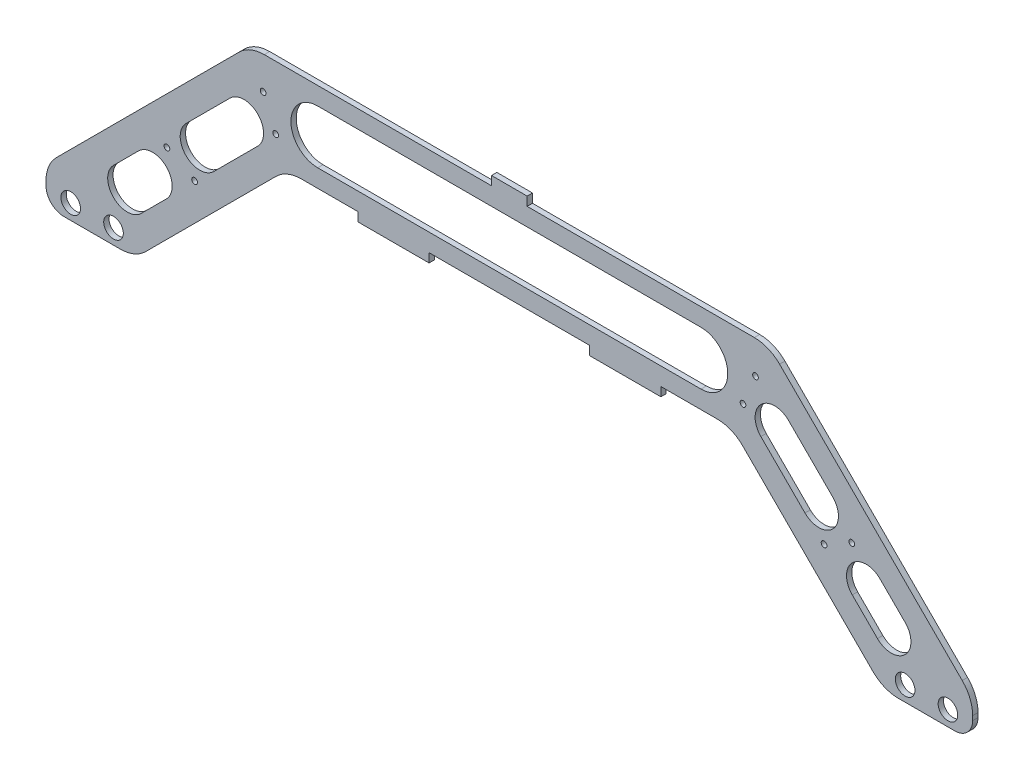
from build123d import *

# Parameters (mm, degrees)
SKETCH_1_R          = 5.5
EXTRUDE_1_DEPTH     = 1.5
CUT_EXTRUDE_6_DEPTH = 283.134941999
SKETCH_2_5_R        = 1.6
CUT_EXTRUDE_7_DEPTH = 283.134941999


with BuildPart() as part:
    # 草图1 → 凸台-拉伸1 (new, symmetric)
    with BuildSketch(Plane.XY):
        with BuildLine():
            Line((-10, 25), (-125, 25))
            Line((-125, 25), (-137.426406871, 25))
            ThreePointArc((-137.426406871, 25), (-145.080075518, 23.47759065), (-151.568542495, 19.142135624))
            Line((-151.568542495, 19.142135624), (-202.781745931, -32.071067812))
            Line((-202.781745931, -32.071067812), (-253.994949366, -83.284271247))
            ThreePointArc((-253.994949366, -83.284271247), (-258.330404393, -89.772738224), (-259.852813742, -97.426406871))
            Line((-259.852813742, -97.426406871), (-259.852813742, -99.852813742))
            ThreePointArc((-259.852813742, -99.852813742), (-256.923881554, -106.923881554), (-249.852813742, -109.852813742))
            Line((-249.852813742, -109.852813742), (-245.994949366, -109.852813742))
            Line((-245.994949366, -109.852813742), (-233.994949366, -109.852813742))
            Line((-233.994949366, -109.852813742), (-218.13708499, -109.852813742))
            ThreePointArc((-218.13708499, -109.852813742), (-210.483416343, -108.330404393), (-203.994949366, -103.994949366))
            Line((-203.994949366, -103.994949366), (-130.857864376, -30.857864376))
            ThreePointArc((-130.857864376, -30.857864376), (-124.3693974, -26.52240935), (-116.715728753, -25))
            Line((-116.715728753, -25), (-85, -25))
            Line((-85, -25), (-85, -30))
            Line((-85, -30), (-65, -30))
            Line((-65, -30), (-45, -30))
            Line((-45, -30), (-45, -25))
            Line((-45, -25), (0, -25))
            Line((0, -25), (45, -25))
            Line((45, -25), (45, -30))
            Line((45, -30), (65, -30))
            Line((65, -30), (85, -30))
            Line((85, -30), (85, -25))
            Line((85, -25), (116.715728753, -25))
            ThreePointArc((116.715728753, -25), (124.3693974, -26.52240935), (130.857864376, -30.857864376))
            Line((130.857864376, -30.857864376), (203.994949366, -103.994949366))
            ThreePointArc((203.994949366, -103.994949366), (210.483416343, -108.330404393), (218.13708499, -109.852813742))
            Line((218.13708499, -109.852813742), (249.852813742, -109.852813742))
            ThreePointArc((249.852813742, -109.852813742), (256.923881554, -106.923881554), (259.852813742, -99.852813742))
            Line((259.852813742, -99.852813742), (259.852813742, -97.426406871))
            ThreePointArc((259.852813742, -97.426406871), (258.330404393, -89.772738224), (253.994949366, -83.284271247))
            Line((253.994949366, -83.284271247), (202.781745931, -32.071067812))
            Line((202.781745931, -32.071067812), (151.568542495, 19.142135624))
            ThreePointArc((151.568542495, 19.142135624), (145.080075518, 23.47759065), (137.426406871, 25))
            Line((137.426406871, 25), (125, 25))
            Line((125, 25), (10, 25))
            Line((10, 25), (10, 30))
            Line((10, 30), (-10, 30))
            Line((-10, 30), (-10, 25))
        make_face()
        with BuildLine():
            ThreePointArc((-240.494949366, -101.352813742), (-242.10586207, -105.241901039), (-245.994949366, -106.852813742))
            ThreePointArc((-245.994949366, -106.852813742), (-249.884036663, -97.463726446), (-240.494949366, -101.352813742))
        make_face(mode=Mode.SUBTRACT)
        with Locations((-221.994949366, -101.352813742)):
            Circle(SKETCH_1_R, mode=Mode.SUBTRACT)
        with Locations((221.994949366, -101.352813742)):
            Circle(SKETCH_1_R, mode=Mode.SUBTRACT)
        with Locations((245.994949366, -101.352813742)):
            Circle(SKETCH_1_R, mode=Mode.SUBTRACT)
    extrude(amount=EXTRUDE_1_DEPTH, both=True)

    # 草图2 → 切除-拉伸6 (cut, through all)
    with BuildSketch(Plane.XY.offset(1.5)):
        with BuildLine():
            Line((107.5, 15), (-107.5, 15))
            ThreePointArc((-107.5, 15), (-122.5, 0), (-107.5, -15))
            Line((-107.5, -15), (107.5, -15))
            ThreePointArc((107.5, -15), (122.5, 0), (107.5, 15))
        make_face()
    extrude(amount=-CUT_EXTRUDE_6_DEPTH, mode=Mode.SUBTRACT)

    # 草图2<5> → 切除-拉伸7 (cut, through all)
    with BuildSketch(Plane.XY.offset(1.5)):
        with Locations((-138.075378798, 6.566756826)):
            Circle(SKETCH_2_5_R)
        with Locations((-131.045941546, -10.403805922)):
            Circle(SKETCH_2_5_R)
        with Locations((-176.520445456, -55.878309832)):
            Circle(SKETCH_2_5_R)
        with Locations((-192.035164082, -47.393028458)):
            Circle(SKETCH_2_5_R)
        with Locations((131.045941546, -10.403805922)):
            Circle(SKETCH_2_5_R)
        with Locations((138.075378798, 6.566756826)):
            Circle(SKETCH_2_5_R)
        with Locations((176.520445456, -55.878309832)):
            Circle(SKETCH_2_5_R)
        with Locations((192.035164082, -47.393028458)):
            Circle(SKETCH_2_5_R)
        with BuildLine():
            Line((-141.060660172, -21.261670299), (-165.809397513, -46.01040764))
            ThreePointArc((-165.809397513, -46.01040764), (-181.365746699, -46.01040764), (-181.365746699, -30.454058454))
            Line((-181.365746699, -30.454058454), (-156.617009358, -5.705321112))
            ThreePointArc((-156.617009358, -5.705321112), (-141.060660172, -5.705321112), (-141.060660172, -21.261670299))
        make_face()
        with BuildLine():
            Line((-222.024386618, -71.112698372), (-207.882250994, -56.970562748))
            ThreePointArc((-207.882250994, -56.970562748), (-192.325901808, -56.970562748), (-192.325901808, -72.526911935))
            Line((-192.325901808, -72.526911935), (-206.468037432, -86.669047558))
            ThreePointArc((-206.468037432, -86.669047558), (-222.024386618, -86.669047558), (-222.024386618, -71.112698372))
        make_face()
        with BuildLine():
            Line((141.060660172, -21.261670299), (165.809397513, -46.01040764))
            ThreePointArc((165.809397513, -46.01040764), (181.365746699, -46.01040764), (181.365746699, -30.454058454))
            Line((181.365746699, -30.454058454), (156.617009358, -5.705321112))
            ThreePointArc((156.617009358, -5.705321112), (141.060660172, -5.705321112), (141.060660172, -21.261670299))
        make_face()
        with BuildLine():
            Line((222.024386618, -71.112698372), (207.882250994, -56.970562748))
            ThreePointArc((207.882250994, -56.970562748), (192.325901808, -56.970562748), (192.325901808, -72.526911935))
            Line((192.325901808, -72.526911935), (206.468037432, -86.669047558))
            ThreePointArc((206.468037432, -86.669047558), (222.024386618, -86.669047558), (222.024386618, -71.112698372))
        make_face()
    extrude(amount=-CUT_EXTRUDE_7_DEPTH, mode=Mode.SUBTRACT)


solid = part.part
